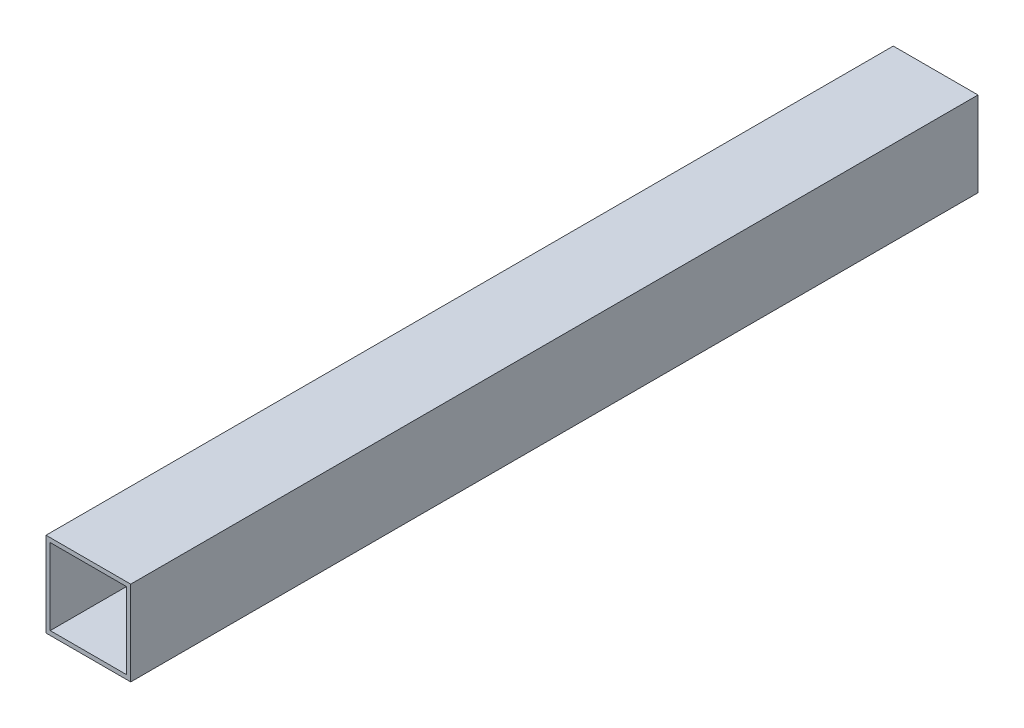
from build123d import *

# Parameters (mm, degrees)
ESQUISSE1_W        = 1000
ESQUISSE1_H        = 1000
ESQUISSE1_W_2      = 900
ESQUISSE1_H_2      = 900
BOSS_EXTRU_1_DEPTH = 10000


with BuildPart() as part:
    # Esquisse1 → Boss.-Extru.1 (new body)
    with BuildSketch(Plane.XY):
        Rectangle(ESQUISSE1_W, ESQUISSE1_H)
        Rectangle(ESQUISSE1_W_2, ESQUISSE1_H_2, mode=Mode.SUBTRACT)
    extrude(amount=BOSS_EXTRU_1_DEPTH)


solid = part.part
